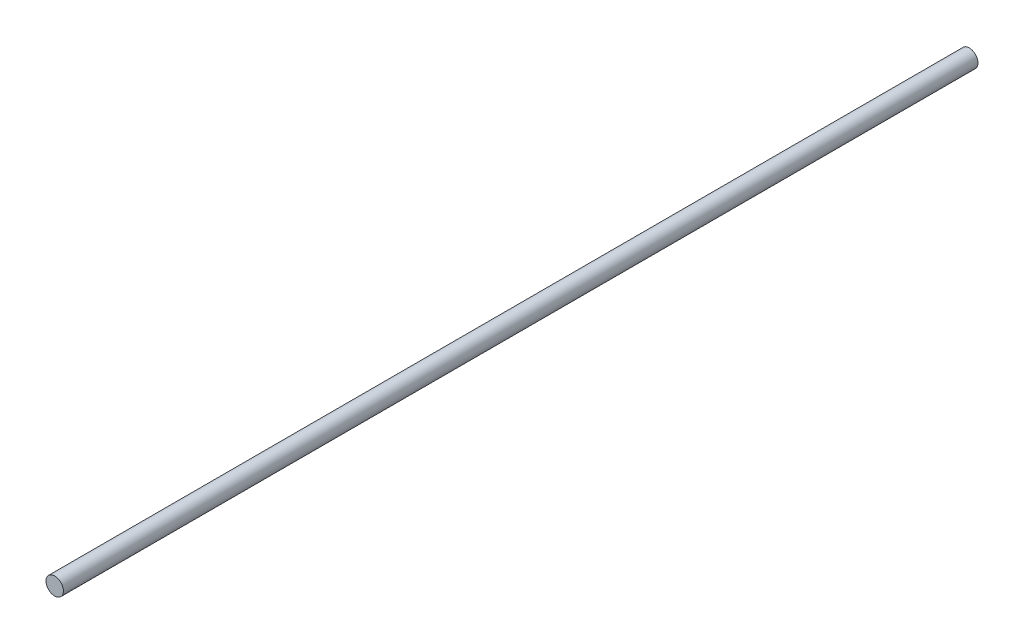
from build123d import *

# Parameters (mm, degrees)
SKETCH1_R           = 4
BOSS_EXTRUDE1_DEPTH = 420


with BuildPart() as part:
    # Sketch1 → Boss-Extrude1 (new body)
    with BuildSketch(Plane.XY):
        Circle(SKETCH1_R)
    extrude(amount=BOSS_EXTRUDE1_DEPTH)


solid = part.part
